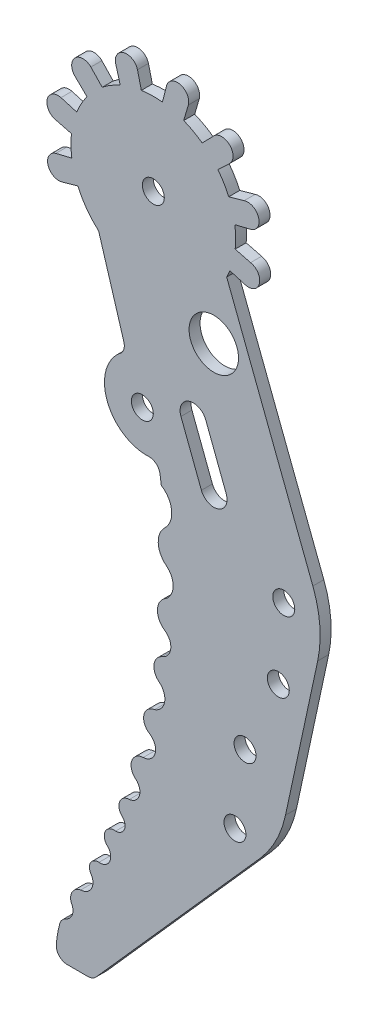
from build123d import *

# Parameters (mm, degrees)
SKETCH1_R           = 1
SKETCH1_R_2         = 2.25
SKETCH1_R_3         = 0.998074624
BOSS_EXTRUDE2_DEPTH = 1


with BuildPart() as part:
    # Sketch1 → Boss-Extrude2 (new body)
    with BuildSketch(Plane.XY):
        with BuildLine():
            Line((5.146977165, -5.612602972), (7.44171219, -13.199988708))
            ThreePointArc((7.44171219, -13.199988708), (7.439945118, -13.784749424), (7.111476, -14.268543033))
            ThreePointArc((7.111476, -14.268543033), (5.923924569, -18.62818009), (9.697794763, -21.113057841))
            ThreePointArc((9.697794763, -21.113057841), (10.380528536, -21.341854348), (10.732574986, -21.969975788))
            ThreePointArc((10.732574986, -21.969975788), (10.79176698, -22.393908793), (10.847713449, -22.818282305))
            ThreePointArc((10.847713449, -22.818282305), (11.790244876, -24.335347863), (11.163215941, -26.007678007))
            ThreePointArc((11.163215941, -26.007678007), (10.570290463, -27.483765064), (11.290805177, -28.901951289))
            ThreePointArc((11.290805177, -28.901951289), (11.931562756, -30.214937196), (11.277042335, -31.52111685))
            ThreePointArc((11.277042335, -31.52111685), (10.500432467, -32.761716535), (11.145287396, -34.075631519))
            ThreePointArc((11.145287396, -34.075631519), (11.711049486, -35.240414103), (10.937199745, -36.278663489))
            ThreePointArc((10.937199745, -36.278663489), (10.185540032, -37.265502357), (10.650830557, -38.415436269))
            ThreePointArc((10.650830557, -38.415436269), (11.153884573, -39.735845823), (10.230304321, -40.805212107))
            ThreePointArc((10.230304321, -40.805212107), (9.263580844, -41.700908083), (9.768401259, -42.918274877))
            ThreePointArc((9.768401259, -42.918274877), (10.29278617, -44.215864041), (9.202326649, -45.093141196))
            ThreePointArc((9.202326649, -45.093141196), (8.144843355, -45.909982105), (8.571180325, -47.176369398))
            ThreePointArc((8.571180325, -47.176369398), (8.845608938, -48.309992252), (7.932024848, -49.035096348))
            ThreePointArc((7.932024848, -49.035096348), (7.054134874, -49.652663659), (7.297145805, -50.698142438))
            ThreePointArc((7.297145805, -50.698142438), (7.486031135, -51.627523472), (6.693279806, -52.148073283))
            ThreePointArc((6.693279806, -52.148073283), (5.736341709, -52.667939714), (5.979078831, -53.729575393))
            ThreePointArc((5.979078831, -53.729575393), (6.146574337, -54.831276595), (5.172832259, -55.373149872))
            ThreePointArc((5.172832259, -55.373149872), (4.397991341, -55.805643097), (4.477975588, -56.689402883))
            ThreePointArc((4.477975588, -56.689402883), (4.477842946, -57.805544451), (3.519463877, -58.377629741))
            ThreePointArc((3.519463877, -58.377629741), (2.763689302, -58.882818754), (2.639049746, -59.78330536))
            ThreePointArc((2.639049746, -59.78330536), (2.762025793, -60.669472955), (2.167842085, -61.338324084))
            ThreePointArc((2.167842085, -61.338324084), (1.808869059, -61.604258533), (1.601521968, -61.999973009))
            ThreePointArc((1.601521968, -61.999973009), (1.407536389, -62.888842845), (1.289722883, -63.790973638))
            ThreePointArc((1.289722883, -63.790973638), (1.548602642, -64.553775113), (2.285909866, -64.878217524))
            Line((2.285909866, -64.878217524), (4.16607409, -64.878217524))
            ThreePointArc((4.16607409, -64.878217524), (4.576078061, -64.790301261), (4.913989999, -64.54201101))
            Line((4.913989999, -64.54201101), (19.858030846, -47.704114694))
            ThreePointArc((19.858030846, -47.704114694), (21.299586827, -45.585122466), (22.155211357, -43.169316519))
            Line((22.155211357, -43.169316519), (25.087470282, -29.538838187))
            ThreePointArc((25.087470282, -29.538838187), (25.281255234, -26.663292069), (24.646889926, -23.851904734))
            Line((24.646889926, -23.851904734), (16.800568019, -3.412304746))
            ThreePointArc((16.800568019, -3.412304746), (16.953922391, -3.093842948), (17.092102067, -2.768509492))
            Line((17.092102067, -2.768509492), (18.525386899, -3.188095126))
            ThreePointArc((18.525386899, -3.188095126), (19.785478354, -2.423398267), (18.979727986, -1.189154327))
            Line((18.979727986, -1.189154327), (17.575945858, -0.827918039))
            ThreePointArc((17.575945858, -0.827918039), (17.62064019, 0.130893048), (17.54251106, 1.087560245))
            Line((17.54251106, 1.087560245), (18.993564953, 1.440830843))
            ThreePointArc((18.993564953, 1.440830843), (19.702487734, 2.733123476), (18.387565476, 3.399134899))
            Line((18.387565476, 3.399134899), (16.991236349, 3.010083636))
            ThreePointArc((16.991236349, 3.010083636), (16.550537232, 3.862785562), (16.004541822, 4.652219092))
            Line((16.004541822, 4.652219092), (17.084556057, 5.68368735))
            ThreePointArc((17.084556057, 5.68368735), (17.052354878, 7.157306991), (15.580593087, 7.076628673))
            Line((15.580593087, 7.076628673), (14.565862222, 6.041535833))
            ThreePointArc((14.565862222, 6.041535833), (13.757854628, 6.559647804), (12.890291968, 6.97031959))
            Line((12.890291968, 6.97031959), (13.309877602, 8.403604423))
            ThreePointArc((13.309877602, 8.403604423), (12.545180743, 9.663695877), (11.310936803, 8.857945509))
            Line((11.310936803, 8.857945509), (10.949700516, 7.454163382))
            ThreePointArc((10.949700516, 7.454163382), (9.990889428, 7.498857714), (9.034222232, 7.420728584))
            Line((9.034222232, 7.420728584), (8.680951634, 8.871782476))
            ThreePointArc((8.680951634, 8.871782476), (7.388659, 9.580705258), (6.722647578, 8.265783))
            Line((6.722647578, 8.265783), (7.11169884, 6.869453872))
            ThreePointArc((7.11169884, 6.869453872), (6.258996915, 6.428754755), (5.469563385, 5.882759346))
            Line((5.469563385, 5.882759346), (4.438095126, 6.96277358))
            ThreePointArc((4.438095126, 6.96277358), (2.964475486, 6.930572401), (3.045153803, 5.45881061))
            Line((3.045153803, 5.45881061), (4.080246644, 4.444079745))
            ThreePointArc((4.080246644, 4.444079745), (3.562134673, 3.636072152), (3.151462886, 2.768509492))
            Line((3.151462886, 2.768509492), (1.718178054, 3.188095126))
            ThreePointArc((1.718178054, 3.188095126), (0.458086599, 2.423398267), (1.263836967, 1.189154327))
            Line((1.263836967, 1.189154327), (2.667619095, 0.827918039))
            ThreePointArc((2.667619095, 0.827918039), (2.622924763, -0.130893048), (2.701053893, -1.087560245))
            Line((2.701053893, -1.087560245), (1.25, -1.440830843))
            ThreePointArc((1.25, -1.440830843), (0.541077219, -2.733123476), (1.855999477, -3.399134899))
            Line((1.855999477, -3.399134899), (3.252328604, -3.010083636))
            ThreePointArc((3.252328604, -3.010083636), (4.058376204, -4.414193514), (5.146977165, -5.612602972))
        make_face()
        with Locations((10.121782476, 0)):
            Circle(SKETCH1_R, mode=Mode.SUBTRACT)
        with Locations((15.627966379, -9.260281964)):
            Circle(SKETCH1_R_2, mode=Mode.SUBTRACT)
        with Locations((9.121782476, -17.526259213)):
            Circle(SKETCH1_R_3, mode=Mode.SUBTRACT)
        with Locations((22, -26.49969455)):
            Circle(SKETCH1_R, mode=Mode.SUBTRACT)
        with Locations((21.5, -33.166361217)):
            Circle(SKETCH1_R, mode=Mode.SUBTRACT)
        with Locations((18.474150388, -39.833027883)):
            Circle(SKETCH1_R, mode=Mode.SUBTRACT)
        with Locations((17.55481685, -46.49969455)):
            Circle(SKETCH1_R, mode=Mode.SUBTRACT)
        with BuildLine():
            Line((14.500290742, -21.375988683), (12.638736062, -16.487053928))
            ThreePointArc((12.638736062, -16.487053928), (13.337027802, -14.929994394), (14.894087335, -15.628286133))
            Line((14.894087335, -15.628286133), (16.755642015, -20.517220889))
            ThreePointArc((16.755642015, -20.517220889), (16.057350276, -22.074280422), (14.500290742, -21.375988683))
        make_face(mode=Mode.SUBTRACT)
    extrude(amount=BOSS_EXTRUDE2_DEPTH)


solid = part.part
